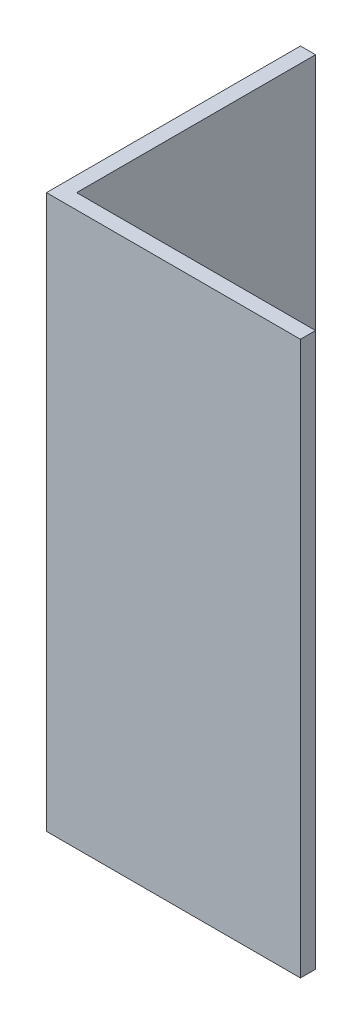
from build123d import *

# Parameters (mm, degrees)
BOSS_EXTRUDE1_DEPTH = 110


with BuildPart() as part:
    # Sketch1 → Boss-Extrude1 (new body)
    with BuildSketch(Plane(origin=(0, 0, 0), x_dir=(1, 0, 0), z_dir=(0, 1, 0))):
        Polygon((0, 47.5), (0, 0), (47.5, 0), (47.5, -3), (-3, -3), (-3, 47.5), align=None)
    extrude(amount=BOSS_EXTRUDE1_DEPTH)


solid = part.part
